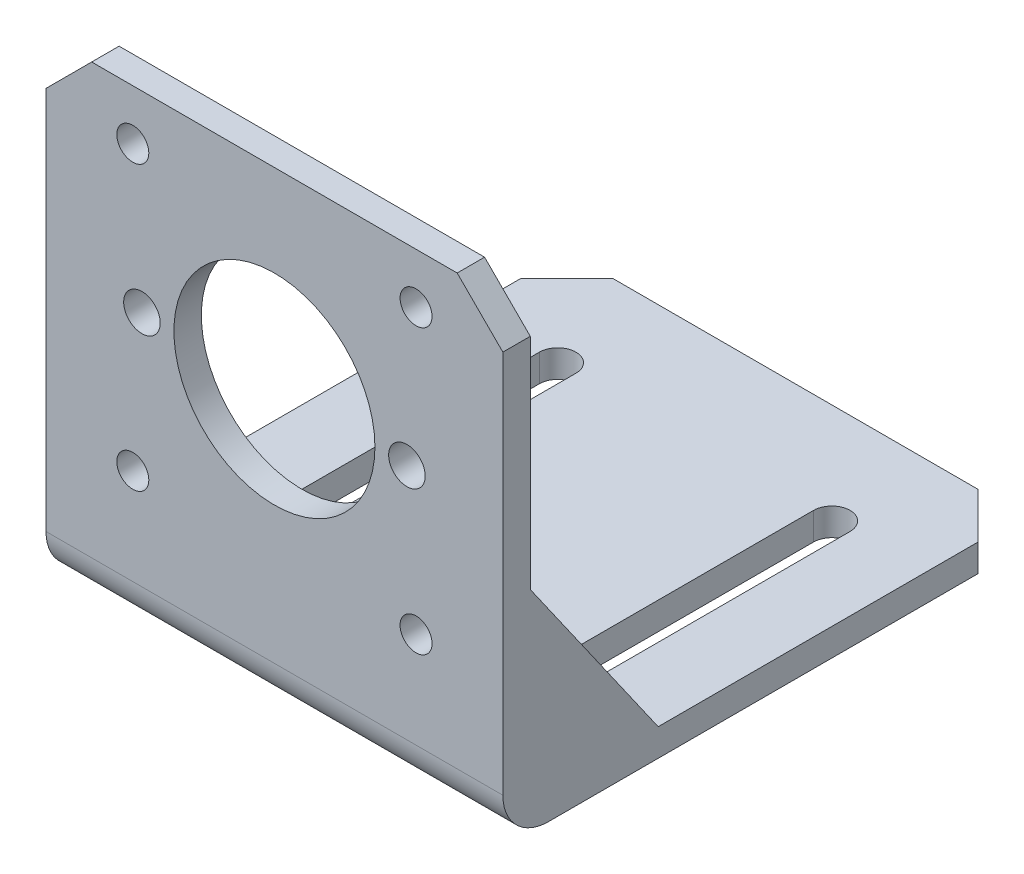
from build123d import *

# Parameters (mm, degrees)
SKETCH_1_W          = 50
SKETCH_1_H          = 52
EXTRUDE_1_DEPTH     = 3
SKETCH_2_W          = 50
SKETCH_2_H          = 3
EXTRUDE_2_DEPTH     = 54
SKETCH_3_R          = 11
SKETCH_3_R_2        = 2
SKETCH_3_R_3        = 1.75
CUT_EXTRUDE_1_DEPTH = 68.453687816
CHAMFER_1_SIZE      = 5
CHAMFER_2_SIZE      = 5
CUT_EXTRUDE_2_DEPTH = 80.025312401
EXTRUDE_START       = -50
EXTRUDE_3_DEPTH     = 50
CUT_EXTRUDE_START   = -3
CUT_EXTRUDE_3_DEPTH = 44
FILLET_1_R          = 5


with BuildPart() as part:
    # 草圖1 → 填料-伸長1 (new body)
    with BuildSketch(Plane.XY):
        Rectangle(SKETCH_1_W, SKETCH_1_H)
    extrude(amount=EXTRUDE_1_DEPTH)

    # 草圖2 → 填料-伸長2 (add)
    with BuildSketch(Plane(origin=(0, 0, 0), x_dir=(-1, 0, 0), z_dir=(0, 0, -1))):
        with Locations((0, -24.5)):
            Rectangle(SKETCH_2_W, SKETCH_2_H)
    extrude(amount=EXTRUDE_2_DEPTH)

    # 草圖3 → 除料-伸長1 (cut, through all)
    with BuildSketch(Plane.XY.offset(3)):
        with Locations((0, 5)):
            Circle(SKETCH_3_R)
        with Locations((14.5, 5)):
            Circle(SKETCH_3_R_2)
        with Locations((-14.5, 5)):
            Circle(SKETCH_3_R_2)
        with Locations((-15.5, -10.5)):
            Circle(SKETCH_3_R_3)
        with Locations((-15.5, 20.5)):
            Circle(SKETCH_3_R_3)
        with Locations((15.5, 20.5)):
            Circle(SKETCH_3_R_3)
        with Locations((15.5, -10.5)):
            Circle(SKETCH_3_R_3)
    extrude(amount=-CUT_EXTRUDE_1_DEPTH, mode=Mode.SUBTRACT)

    # 導角1
    chamfer_1_edges = [part.edges().sort_by_distance(p)[0] for p in [
        (-25, 26, 1.5),
        (25, 26, 1.5),
    ]]
    chamfer(chamfer_1_edges, length=CHAMFER_1_SIZE)

    # 導角2
    chamfer_2_edges = [part.edges().sort_by_distance(p)[0] for p in [
        (25, -24.5, -54),
        (-25, -24.5, -54),
    ]]
    chamfer(chamfer_2_edges, length=CHAMFER_2_SIZE)

    # 草圖4 → 除料-伸長2 (cut, through all)
    with BuildSketch(Plane.XZ.offset(26)):
        with BuildLine():
            Line((13, -43), (13, -13))
            ThreePointArc((13, -13), (15, -11), (17, -13))
            Line((17, -13), (17, -43))
            ThreePointArc((17, -43), (15, -45), (13, -43))
        make_face()
        with BuildLine():
            Line((-13, -43), (-13, -13))
            ThreePointArc((-13, -13), (-15, -11), (-17, -13))
            Line((-17, -13), (-17, -43))
            ThreePointArc((-17, -43), (-15, -45), (-13, -43))
        make_face()
    extrude(amount=-CUT_EXTRUDE_2_DEPTH, mode=Mode.SUBTRACT)

    # 草圖5 → 填料-伸長3 (add)
    with BuildSketch(Plane(origin=(25, 0, 0), x_dir=(0, 0, -1), z_dir=(1, 0, 0)).offset(EXTRUDE_START)):
        Polygon((0, -23), (0, -3), (14, -23), align=None)
    extrude(amount=EXTRUDE_3_DEPTH)

    # 草圖6 → 除料-伸長3 (cut)
    with BuildSketch(Plane(origin=(25, 0, 0), x_dir=(0, 0, -1), z_dir=(1, 0, 0)).offset(CUT_EXTRUDE_START)):
        Polygon((0, -3), (14, -23), (0, -23), align=None)
    extrude(amount=-CUT_EXTRUDE_3_DEPTH, mode=Mode.SUBTRACT)

    # 圓角1
    fillet_1_edges = [part.edges().sort_by_distance(p)[0] for p in [
        (0, -26, 3),
    ]]
    fillet(fillet_1_edges, radius=FILLET_1_R)


solid = part.part
